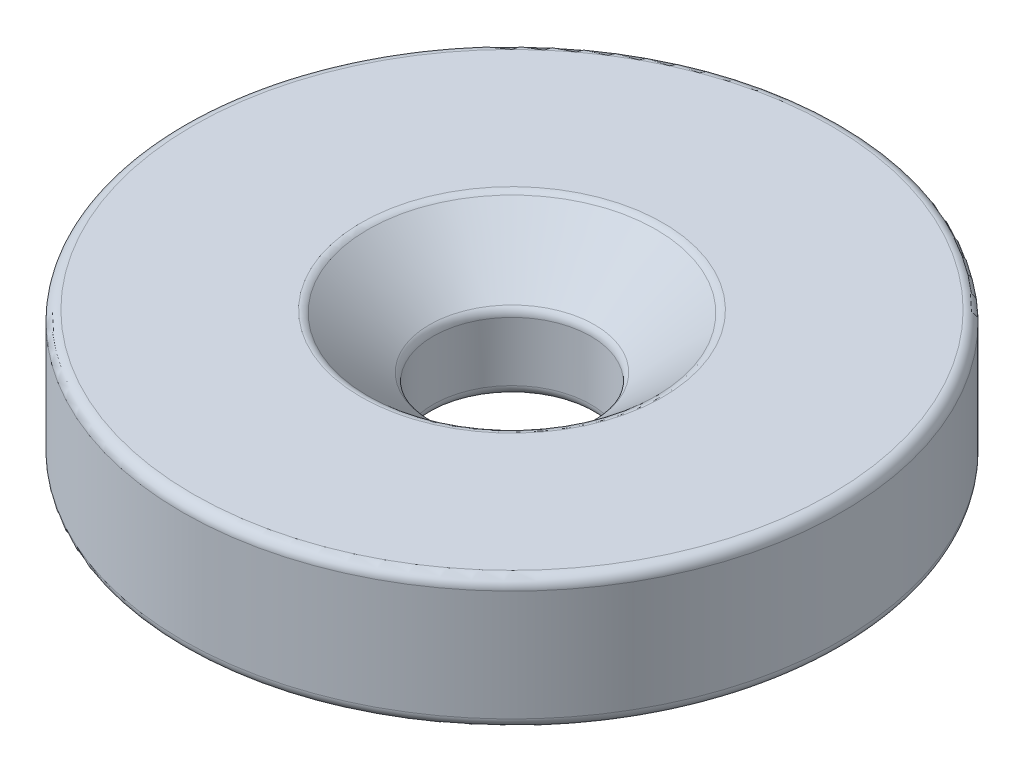
from build123d import *

# Parameters (mm, degrees)
SKETCH1_R                                         = 7.9375
BOSS_EXTRUDE1_DEPTH                               = 1.5875
CSK_FOR_6_FLAT_HEAD_MACHINE_SCREW_100_D           = 3.7973
CSK_FOR_6_FLAT_HEAD_MACHINE_SCREW_100_CSINK_D     = 7.0866
CSK_FOR_6_FLAT_HEAD_MACHINE_SCREW_100_CSINK_ANGLE = 100
FILLET1_R                                         = 0.254


with BuildPart() as part:
    # Sketch1 → Boss-Extrude1 (new, symmetric)
    with BuildSketch(Plane(origin=(0, 0, 0), x_dir=(1, 0, 0), z_dir=(0, 1, 0))):
        with Locations(Location((0, 0, 0), (0, 0, 270))):
            Circle(SKETCH1_R)
    extrude(amount=BOSS_EXTRUDE1_DEPTH, both=True)

    # CSK for #6 Flat Head Machine Screw (100)1 (through all)
    with Locations(Plane(origin=(0, 1.5875, 0), x_dir=(1, 0, 0), z_dir=(0, 1, 0))):
        with Locations((0, 0)):
            CounterSinkHole(CSK_FOR_6_FLAT_HEAD_MACHINE_SCREW_100_D / 2, CSK_FOR_6_FLAT_HEAD_MACHINE_SCREW_100_CSINK_D / 2, counter_sink_angle=CSK_FOR_6_FLAT_HEAD_MACHINE_SCREW_100_CSINK_ANGLE)

    # Fillet1
    fillet1_edges = [part.edges().sort_by_distance(p)[0] for p in [
        (0, -1.5875, -7.9375),
        (0, 1.5875, -7.9375),
        (3.5433, 1.5875, 0),
        (1.89865, -1.5875, 0),
        (1.89865, 0.207474792, 0),
    ]]
    fillet(fillet1_edges, radius=FILLET1_R)


solid = part.part
